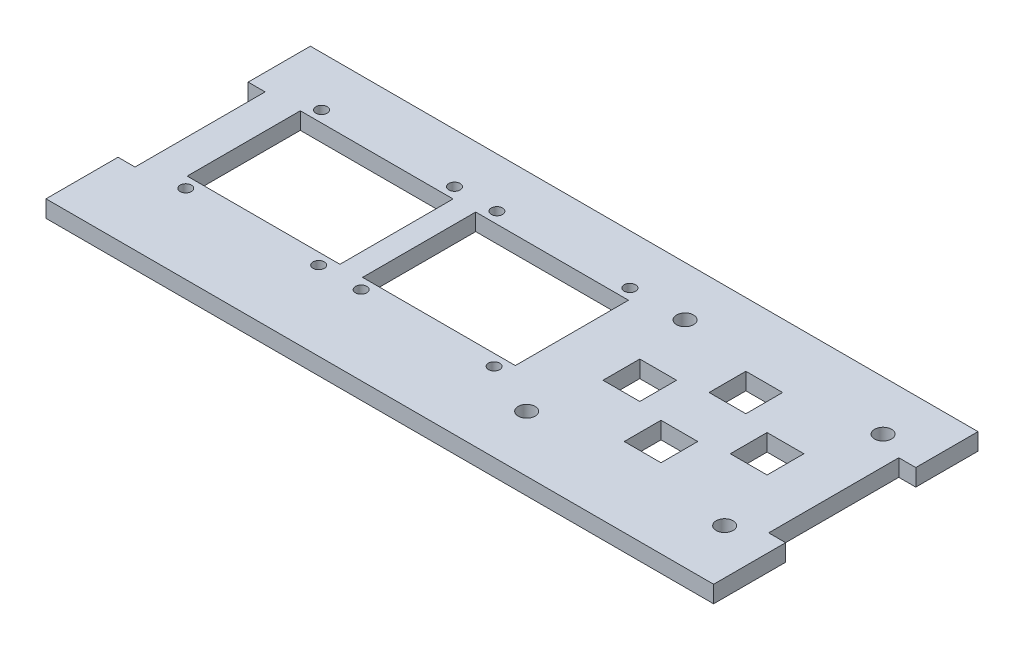
from build123d import *

# Parameters (mm, degrees)
SKETCH1_R           = 1.5
SKETCH1_R_2         = 1
SKETCH1_W           = 27
SKETCH1_H           = 20
SKETCH1_W_2         = 6.5
SKETCH1_H_2         = 6.5
BOSS_EXTRUDE1_DEPTH = 3


with BuildPart() as part:
    # Sketch1 → Boss-Extrude1 (new body)
    with BuildSketch(Plane(origin=(0, 0, 0), x_dir=(1, 0, 0), z_dir=(0, 1, 0))):
        Polygon((-55.548227769, -6.151360111), (-52.548227769, -6.151360111), (-52.548227769, 16.848639889), (-55.548227769, 16.848639889), (-55.548227769, 27.848639889), (62.451772231, 27.848639889), (62.451772231, 16.848639889), (59.451772231, 16.848639889), (59.451772231, -6.151360111), (62.451772231, -6.151360111), (62.451772231, -18.881360111), (-55.548227769, -18.881360111), align=None)
        with Locations(Location((19.451772231, 19.069293812, 0), (0, 0, 270))):
            Circle(SKETCH1_R, mode=Mode.SUBTRACT)
        with Locations(Location((54.451772231, 19.069293812, 0), (0, 0, 270))):
            Circle(SKETCH1_R, mode=Mode.SUBTRACT)
        with Locations(Location((54.451772231, -8.930706188, 0), (0, 0, 270))):
            Circle(SKETCH1_R, mode=Mode.SUBTRACT)
        with Locations(Location((19.451772231, -8.930706188, 0), (0, 0, 270))):
            Circle(SKETCH1_R, mode=Mode.SUBTRACT)
        with Locations(Location((9.701772231, 19.069293812, 0), (0, 0, 270))):
            Circle(SKETCH1_R_2, mode=Mode.SUBTRACT)
        with Locations(Location((9.701772231, -4.930706188, 0), (0, 0, 270))):
            Circle(SKETCH1_R_2, mode=Mode.SUBTRACT)
        with Locations(Location((-13.798227769, -4.930706188, 0), (0, 0, 270))):
            Circle(SKETCH1_R_2, mode=Mode.SUBTRACT)
        with Locations(Location((-13.798227769, 19.069293812, 0), (0, 0, 270))):
            Circle(SKETCH1_R_2, mode=Mode.SUBTRACT)
        with Locations(Location((-44.798227769, 19.069293812, 0), (0, 0, 270))):
            Circle(SKETCH1_R_2, mode=Mode.SUBTRACT)
        with Locations(Location((-21.298227769, 19.069293812, 0), (0, 0, 270))):
            Circle(SKETCH1_R_2, mode=Mode.SUBTRACT)
        with Locations(Location((-44.798227769, -4.930706188, 0), (0, 0, 270))):
            Circle(SKETCH1_R_2, mode=Mode.SUBTRACT)
        with Locations(Location((-21.298227769, -4.930706188, 0), (0, 0, 270))):
            Circle(SKETCH1_R_2, mode=Mode.SUBTRACT)
        with Locations((-2.048227769, 7.069293812)):
            Rectangle(SKETCH1_W, SKETCH1_H, mode=Mode.SUBTRACT)
        with Locations((-33.048227769, 7.069293812)):
            Rectangle(SKETCH1_W, SKETCH1_H, mode=Mode.SUBTRACT)
        with Locations((35.951772231, 13.319293812)):
            Rectangle(SKETCH1_W_2, SKETCH1_H_2, mode=Mode.SUBTRACT)
        with Locations((47.201772231, 5.819293812)):
            Rectangle(SKETCH1_W_2, SKETCH1_H_2, mode=Mode.SUBTRACT)
        with Locations((35.951772231, -1.680706188)):
            Rectangle(SKETCH1_W_2, SKETCH1_H_2, mode=Mode.SUBTRACT)
        with Locations((24.701772231, 5.819293812)):
            Rectangle(SKETCH1_W_2, SKETCH1_H_2, mode=Mode.SUBTRACT)
    extrude(amount=BOSS_EXTRUDE1_DEPTH)


solid = part.part
